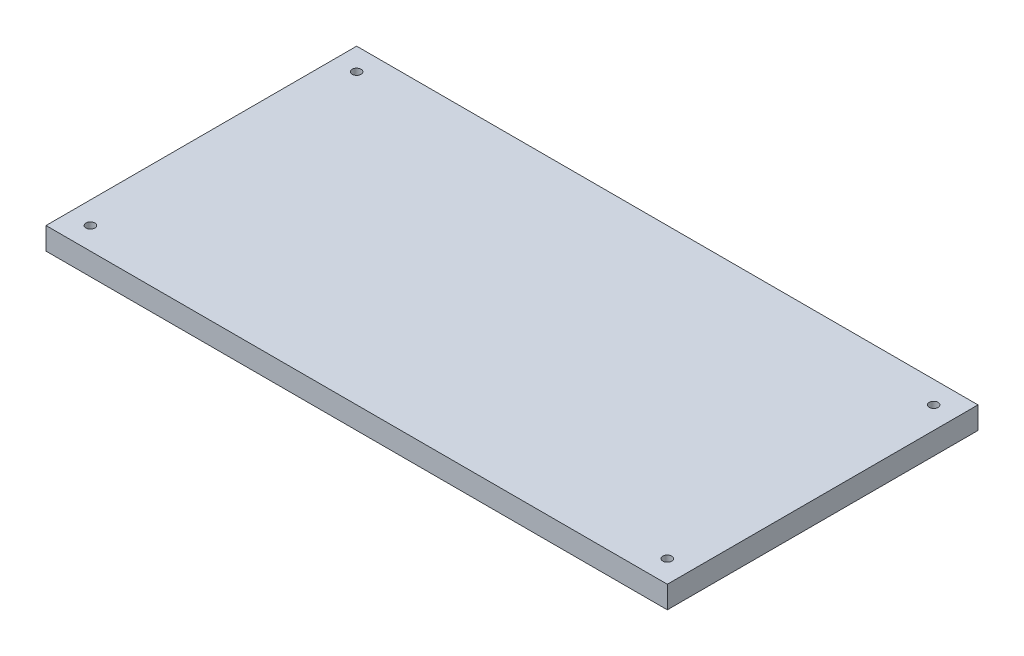
from build123d import *

# Parameters (mm, degrees)
SZKIC1_W                    = 140
SZKIC1_H                    = 70
SZKIC1_R                    = 1
DODANIE_WYCI_GNI_CIE1_DEPTH = 5


with BuildPart() as part:
    # Szkic1 → Dodanie-wyciągnięcie1 (new body)
    with BuildSketch(Plane(origin=(0, 0, 0), x_dir=(1, 0, 0), z_dir=(0, 1, 0))):
        with Locations((70, -35)):
            Rectangle(SZKIC1_W, SZKIC1_H)
        with Locations(Location((135, -65, 0), (0, 0, 270))):
            Circle(SZKIC1_R, mode=Mode.SUBTRACT)
        with Locations(Location((135, -5, 0), (0, 0, 90))):
            Circle(SZKIC1_R, mode=Mode.SUBTRACT)
        with Locations(Location((5, -5, 0), (0, 0, 270))):
            Circle(SZKIC1_R, mode=Mode.SUBTRACT)
        with Locations(Location((5, -65, 0), (0, 0, 90))):
            Circle(SZKIC1_R, mode=Mode.SUBTRACT)
    extrude(amount=DODANIE_WYCI_GNI_CIE1_DEPTH)


solid = part.part
